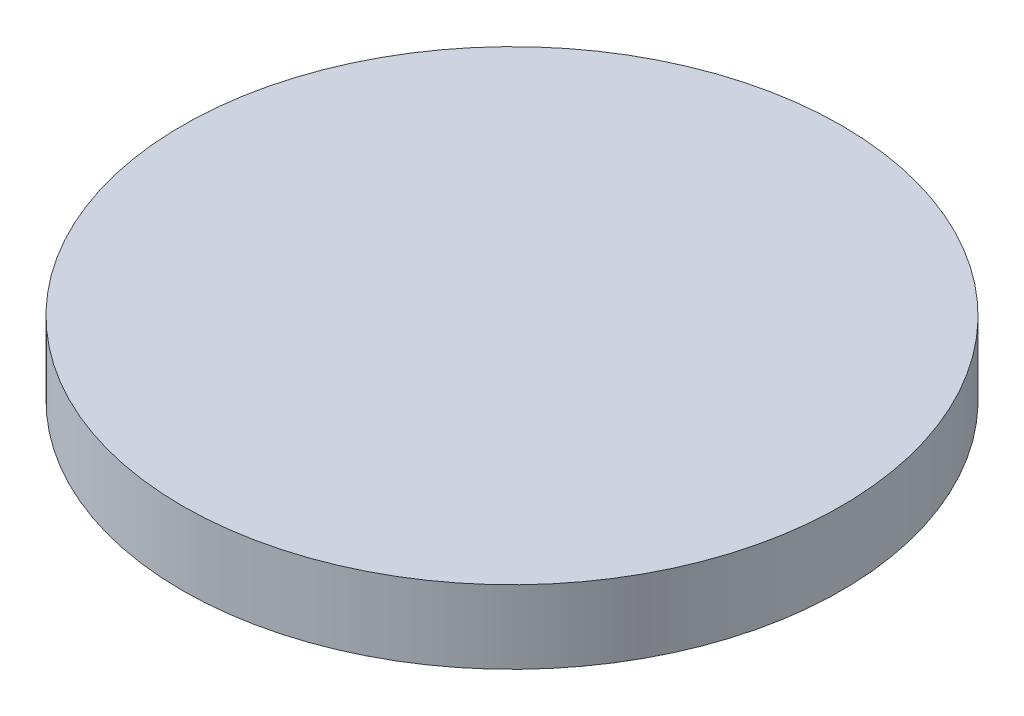
from build123d import *

# Parameters (mm, degrees)
SKETCH1_R           = 19.05
BOSS_EXTRUDE1_DEPTH = 4.233333333
SKETCH4_R           = 0.635
BOSS_EXTRUDE2_DEPTH = 1.27


with BuildPart() as part:
    # Sketch1 → Boss-Extrude1 (new body)
    with BuildSketch(Plane(origin=(0, 0, 0), x_dir=(1, 0, 0), z_dir=(0, 1, 0))):
        with Locations(Location((0, 0, 0), (0, 0, 270))):
            Circle(SKETCH1_R)
    extrude(amount=BOSS_EXTRUDE1_DEPTH)

    # Sketch4 → Boss-Extrude2 (add)
    with BuildSketch(Plane.XZ):
        with Locations(Location((0, 9.525, 0), (0, 0, 90))):
            Circle(SKETCH4_R)
    extrude(amount=BOSS_EXTRUDE2_DEPTH)


solid = part.part
